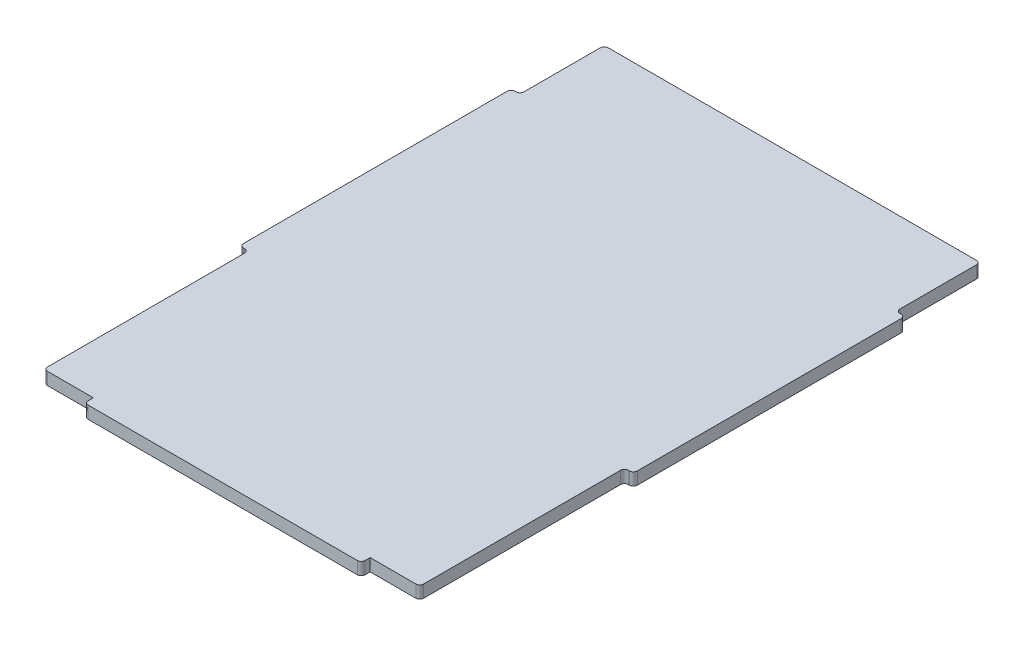
from build123d import *

# Parameters (mm, degrees)
BOSS_EXTRUDE1_DEPTH = 3.175
SKETCH2_W           = 2.286
SKETCH2_H           = 69.616100292
BOSS_EXTRUDE2_DEPTH = 3.175
FILLET1_R           = 1


with BuildPart() as part:
    # Sketch1 → Boss-Extrude1 (new body)
    with BuildSketch(Plane(origin=(0, 0, 0), x_dir=(1, 0, 0), z_dir=(0, 1, 0))):
        Polygon((83.6803, 0), (96.3803, 0), (96.3803, 143.6878), (0, 143.6878), (0, 0), (12.7, 0), (12.7, -2.286), (83.6803, -2.286), align=None)
    extrude(amount=BOSS_EXTRUDE1_DEPTH)

    # Sketch2 → Boss-Extrude2 (add, through all)
    with BuildSketch(Plane.XZ):
        with Locations((-1.143, -87.286990146)):
            Rectangle(SKETCH2_W, SKETCH2_H)
        with Locations((97.5233, -87.286990146)):
            Rectangle(SKETCH2_W, SKETCH2_H)
    extrude(amount=-BOSS_EXTRUDE2_DEPTH)

    # Fillet1
    fillet1_edges = [part.edges().sort_by_distance(p)[0] for p in [
        (0, 1.5875, -143.6878),
        (96.3803, 1.5875, -143.6878),
        (96.3803, 1.5875, 0),
        (83.6803, 1.5875, 2.286),
        (12.7, 1.5875, 2.286),
        (0, 1.5875, 0),
        (0, 1.5875, -52.47894),
        (0, 1.5875, -122.095040292),
        (-2.286, 1.5875, -122.095040292),
        (-2.286, 1.5875, -52.47894),
        (96.3803, 1.5875, -122.095040292),
        (96.3803, 1.5875, -52.47894),
        (98.6663, 1.5875, -52.47894),
        (98.6663, 1.5875, -122.095040292),
    ]]
    fillet(fillet1_edges, radius=FILLET1_R)


solid = part.part
